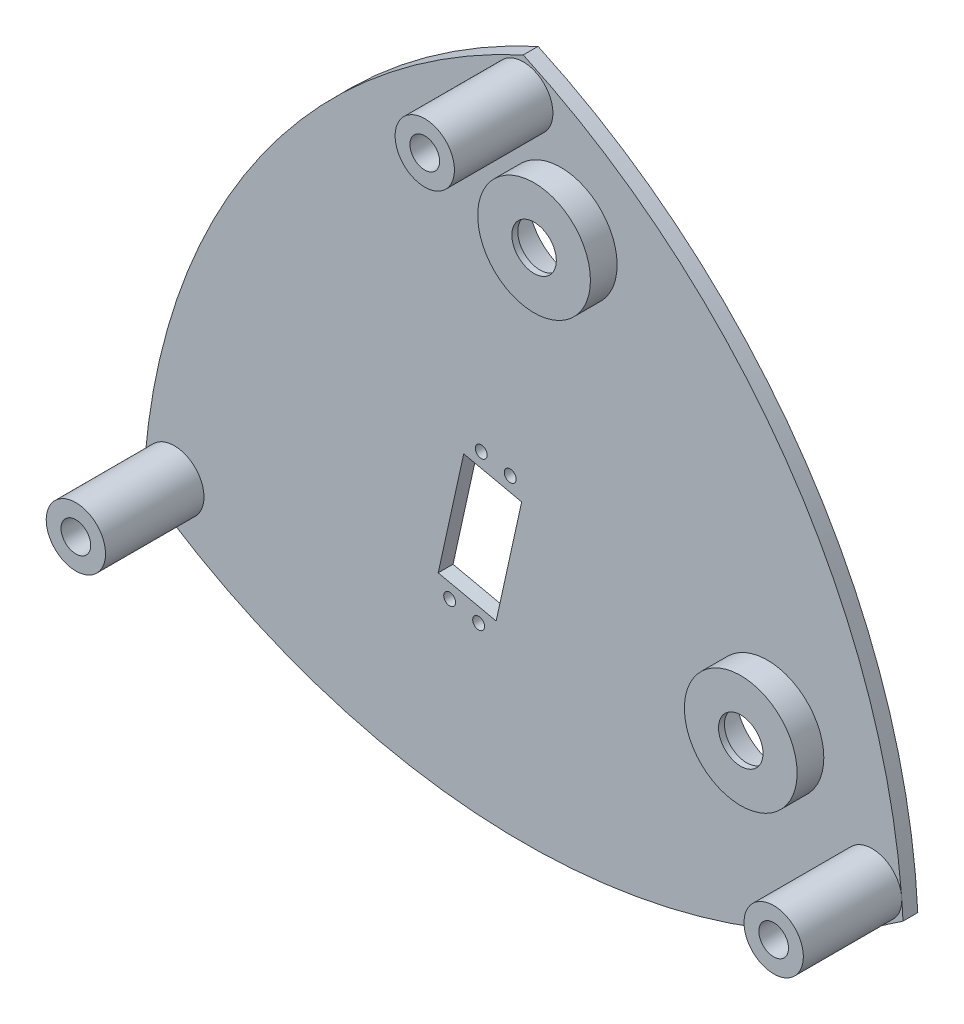
from build123d import *

# Parameters (mm, degrees)
SKETCH_1_R          = 5
EXTRUDE_1_DEPTH     = 5
SKETCH_2_R          = 10
SKETCH_2_R_2        = 5
EXTRUDE_2_DEPTH     = 33.2
SKETCH_4_R          = 16
CUT_EXTRUDE_2_DEPTH = 15
SKETCH_7_R          = 19
SKETCH_7_R_2        = 16
EXTRUDE_3_DEPTH     = 7
SKETCH_8_R          = 19
SKETCH_8_R_2        = 7.5
EXTRUDE_4_DEPTH     = 2
CUT_EXTRUDE_3_DEPTH = 10
SKETCH_10_R         = 2
CUT_EXTRUDE_4_DEPTH = 10


with BuildPart() as part:
    # 草图1 → 凸台-拉伸1 (new body)
    with BuildSketch(Plane.XY):
        with BuildLine():
            ThreePointArc((-128.022678922, -73.913928138), (-90.421378279, 38.440519474), (0, 115))
            ThreePointArc((0, 115), (90.421378279, 38.440519474), (128.022678922, -73.913928138))
            ThreePointArc((128.022678922, -73.913928138), (0, -115), (-128.022678922, -73.913928138))
        make_face()
        with Locations((0, 103)):
            Circle(SKETCH_1_R, mode=Mode.SUBTRACT)
        with Locations((-117.630374076, -67.913928138)):
            Circle(SKETCH_1_R, mode=Mode.SUBTRACT)
        with Locations((117.630374076, -67.913928138)):
            Circle(SKETCH_1_R, mode=Mode.SUBTRACT)
    extrude(amount=EXTRUDE_1_DEPTH)

    # 草图2 → 凸台-拉伸2 (add)
    # profile 1 of 3: a face of its own
    with BuildSketch(Plane.XY.offset(5)):
        with Locations(Location((0, 103, 0), (0, 0, 180))):
            Circle(SKETCH_2_R)
        with Locations((0, 103)):
            Circle(SKETCH_2_R_2, mode=Mode.SUBTRACT)
    # profile 2 of 3: a face of its own
    with BuildSketch(Plane.XY.offset(5)):
        with Locations(Location((-117.630374076, -67.913928138, 0), (0, 0, 179.375778052))):
            Circle(SKETCH_2_R)
        with Locations((-117.630374076, -67.913928138)):
            Circle(SKETCH_2_R_2, mode=Mode.SUBTRACT)
    # profile 3 of 3: a face of its own
    with BuildSketch(Plane.XY.offset(5)):
        with Locations(Location((117.630374076, -67.913928138, 0), (0, 0, 8.696571879))):
            Circle(SKETCH_2_R)
        with Locations((117.630374076, -67.913928138)):
            Circle(SKETCH_2_R_2, mode=Mode.SUBTRACT)
    extrude(amount=EXTRUDE_2_DEPTH)

    # 草图4 → 切除-拉伸2 (cut)
    with BuildSketch(Plane(origin=(0, 0, 0), x_dir=(-1, 0, 0), z_dir=(0, 0, -1))):
        with Locations((-12.650995066, 69.515536741)):
            Circle(SKETCH_4_R)
        with Locations((-82.334125615, -39.530718783)):
            Circle(SKETCH_4_R)
    extrude(amount=-CUT_EXTRUDE_2_DEPTH, mode=Mode.SUBTRACT)

    # 草图7 → 凸台-拉伸3 (add)
    # profile 1 of 2: a face of its own
    with BuildSketch(Plane.XY.offset(5)):
        with Locations((82.334125615, -39.530718783)):
            Circle(SKETCH_7_R)
        with Locations(Location((82.334125615, -39.530718783, 0), (0, 0, 180))):
            Circle(SKETCH_7_R_2, mode=Mode.SUBTRACT)
    # profile 2 of 2: a face of its own
    with BuildSketch(Plane.XY.offset(5)):
        with Locations((12.650995066, 69.515536741)):
            Circle(SKETCH_7_R)
        with Locations(Location((12.650995066, 69.515536741, 0), (0, 0, 180))):
            Circle(SKETCH_7_R_2, mode=Mode.SUBTRACT)
    extrude(amount=EXTRUDE_3_DEPTH)

    # 草图8 → 凸台-拉伸4 (add)
    # profile 1 of 2: a face of its own
    with BuildSketch(Plane.XY.offset(12)):
        with Locations((82.334125615, -39.530718783)):
            Circle(SKETCH_8_R)
        with Locations((82.334125615, -39.530718783)):
            Circle(SKETCH_8_R_2, mode=Mode.SUBTRACT)
    # profile 2 of 2: a face of its own
    with BuildSketch(Plane.XY.offset(12)):
        with Locations((12.650995066, 69.515536741)):
            Circle(SKETCH_8_R)
        with Locations((12.650995066, 69.515536741)):
            Circle(SKETCH_8_R_2, mode=Mode.SUBTRACT)
    extrude(amount=EXTRUDE_4_DEPTH)

    # 草图9 → 切除-拉伸3 (cut)
    with BuildSketch(Plane(origin=(0, 0, 0), x_dir=(-1, 0, 0), z_dir=(0, 0, -1))):
        Polygon((20.065498734, -11.479666127), (28.668863324, -50.543487212), (9.136952782, -54.845169507), (0.533588192, -15.781348422), align=None)
    extrude(amount=-CUT_EXTRUDE_3_DEPTH, mode=Mode.SUBTRACT)

    # 草图10 → 切除-拉伸4 (cut)
    with BuildSketch(Plane.XY.offset(5)):
        with Locations((-24.807535234, -56.257736539)):
            Circle(SKETCH_10_R)
        with Locations((-15.041579962, -58.408577687)):
            Circle(SKETCH_10_R)
        with Locations((-14.160871553, -7.916257947)):
            Circle(SKETCH_10_R)
        with Locations((-4.394916282, -10.067099095)):
            Circle(SKETCH_10_R)
    extrude(amount=-CUT_EXTRUDE_4_DEPTH, mode=Mode.SUBTRACT)


solid = part.part
